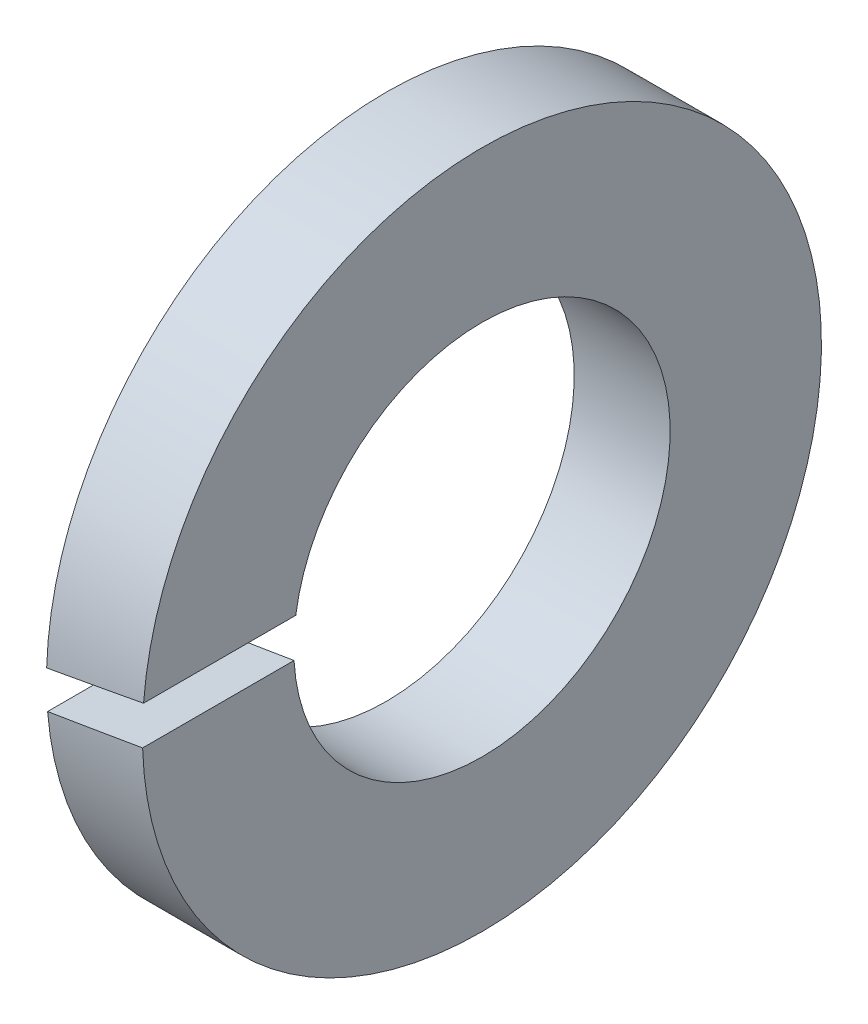
from build123d import *

# Parameters (mm, degrees)
SKETCH1_W          = 1.3
SKETCH1_H          = 2.05
CUT_EXTRUDE1_DEPTH = 7.634003316


with BuildPart() as part:
    # Sketch1 → Revolve1 (revolve)
    with BuildSketch(Plane.XY, mode=Mode.PRIVATE) as revolve1_sk:
        with Locations((-0.65, 3.575)):
            Rectangle(SKETCH1_W, SKETCH1_H)
    revolve(revolve1_sk.sketch.rotate(Axis((-1.3, 0, 0), (1, 0, 0)), 90), axis=Axis((-1.3, 0, 0), (1, 0, 0)))

    # Sketch2 → Cut-Extrude1 (cut, through all)
    with BuildSketch(Plane.XY):
        Polygon((-1.3, 0.144321249), (0, 0.373546323), (0, -0.144321249), (-1.3, -0.373546323), align=None)
    extrude(amount=CUT_EXTRUDE1_DEPTH, mode=Mode.SUBTRACT)


solid = part.part
